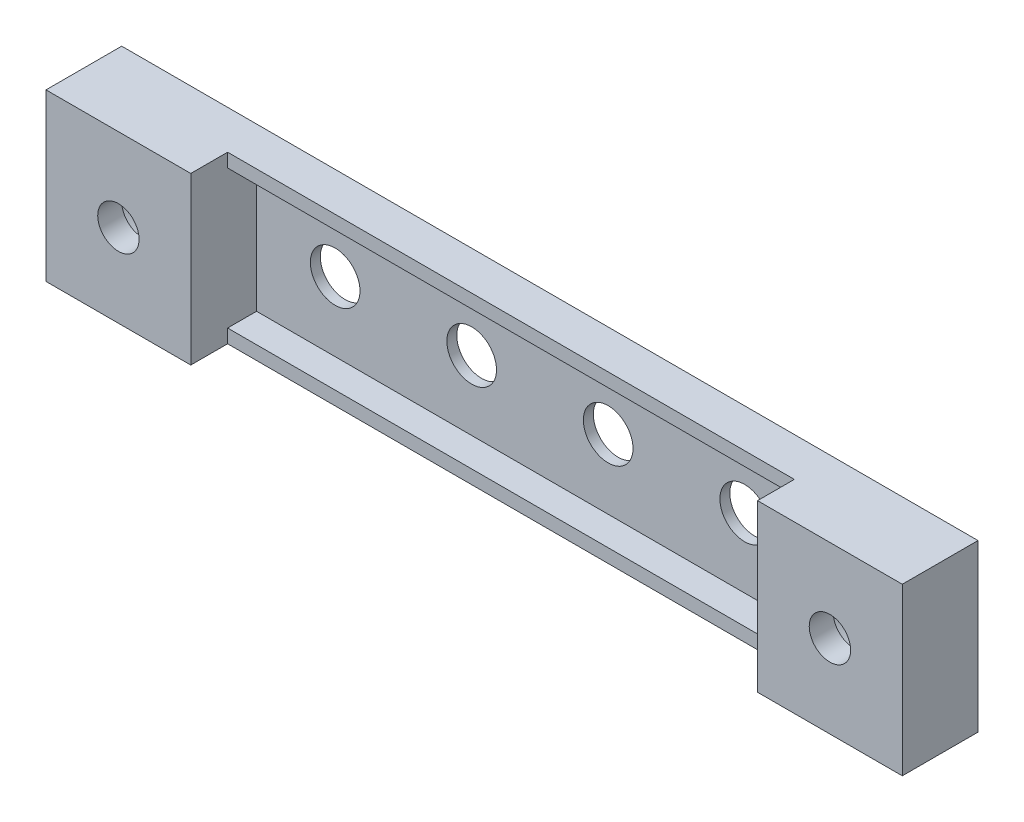
from build123d import *

# Parameters (mm, degrees)
SKETCH_1_W          = 27.4
SKETCH_1_H          = 6.7
EXTRUDE_1_DEPTH     = 1.4
SKETCH_2_W          = 3
SKETCH_2_H          = 8.022879097
EXTRUDE_2_DEPTH     = 1.78
SKETCH_3_W          = 33.4
SKETCH_3_H          = 8.022879097
EXTRUDE_6_DEPTH     = 0.58
SKETCH_4_R          = 1.2
CUT_EXTRUDE_1_DEPTH = 1
SKETCH_6_W          = 33.4
SKETCH_6_H          = 8.022879097
CUT_EXTRUDE_3_DEPTH = 0.1
SKETCH_7_W          = 3.66
SKETCH_7_H          = 8.022879097
EXTRUDE_7_DEPTH     = 4
SKETCH_8_R          = 2.5
CUT_EXTRUDE_4_DEPTH = 2.5
SKETCH_9_R          = 1
CUT_EXTRUDE_5_DEPTH = 5
SKETCH_10_W         = 3.66
SKETCH_10_H         = 8.022879097
EXTRUDE_8_DEPTH     = 4
SKETCH_11_R         = 2.5
CUT_EXTRUDE_6_DEPTH = 2.5
SKETCH_12_R         = 1
CUT_EXTRUDE_7_DEPTH = 2.5


with BuildPart() as part:
    # 스케치1 → 보스-돌출1 (new body)
    with BuildSketch(Plane.XY):
        Polygon((-16.7, -0.330719774), (16.7, -0.330719774), (16.7, 0.330719774), (16.7, 7.030719774), (16.7, 7.692159323), (-16.7, 7.692159323), (-16.7, 7.030719774), (-16.7, 0.330719774), align=None)
        with Locations((0, 3.680719774)):
            Rectangle(SKETCH_1_W, SKETCH_1_H, mode=Mode.SUBTRACT)
    extrude(amount=EXTRUDE_1_DEPTH)

    # 스케치2 → 보스-돌출2 (add)
    with BuildSketch(Plane.XY.offset(1.4)):
        with Locations((-15.2, 3.680719774)):
            Rectangle(SKETCH_2_W, SKETCH_2_H)
        with Locations((15.2, 3.680719774)):
            Rectangle(SKETCH_2_W, SKETCH_2_H)
    extrude(amount=EXTRUDE_2_DEPTH)

    # 스케치3 → 보스-돌출6 (add)
    with BuildSketch(Plane(origin=(0, 0, 0), x_dir=(-1, 0, 0), z_dir=(0, 0, -1))):
        with Locations((0, 3.680719774)):
            Rectangle(SKETCH_3_W, SKETCH_3_H)
    extrude(amount=EXTRUDE_6_DEPTH)

    # 스케치4 → 컷-돌출1 (cut)
    with BuildSketch(Plane(origin=(0, 0, -0.58), x_dir=(-1, 0, 0), z_dir=(0, 0, -1))):
        with Locations((-9.9, 3.680719774)):
            Circle(SKETCH_4_R)
        with Locations((-3.3, 3.680719774)):
            Circle(SKETCH_4_R)
        with Locations((3.3, 3.680719774)):
            Circle(SKETCH_4_R)
        with Locations((9.9, 3.680719774)):
            Circle(SKETCH_4_R)
    extrude(amount=-CUT_EXTRUDE_1_DEPTH, mode=Mode.SUBTRACT)

    # 스케치6 → 컷-돌출3 (cut)
    with BuildSketch(Plane(origin=(0, 0, -0.58), x_dir=(-1, 0, 0), z_dir=(0, 0, -1))):
        with Locations((0, 3.680719774)):
            Rectangle(SKETCH_6_W, SKETCH_6_H)
    extrude(amount=-CUT_EXTRUDE_3_DEPTH, mode=Mode.SUBTRACT)

    # 스케치7 → 보스-돌출7 (add)
    with BuildSketch(Plane.ZY.offset(16.7)):
        with Locations((1.35, 3.680719774)):
            Rectangle(SKETCH_7_W, SKETCH_7_H)
    extrude(amount=EXTRUDE_7_DEPTH)

    # 스케치8 → 컷-돌출4 (cut)
    with BuildSketch(Plane(origin=(0, 0, -0.48), x_dir=(-1, 0, 0), z_dir=(0, 0, -1))):
        with Locations((17.2, 3.680719774)):
            Circle(SKETCH_8_R)
    extrude(amount=-CUT_EXTRUDE_4_DEPTH, mode=Mode.SUBTRACT)

    # 스케치9 → 컷-돌출5 (cut)
    with BuildSketch(Plane(origin=(0, 0, 2.02), x_dir=(-1, 0, 0), z_dir=(0, 0, -1))):
        with Locations((17.2, 3.680719774)):
            Circle(SKETCH_9_R)
    extrude(amount=-CUT_EXTRUDE_5_DEPTH, mode=Mode.SUBTRACT)

    # 스케치10 → 보스-돌출8 (add)
    with BuildSketch(Plane(origin=(16.7, 0, 0), x_dir=(0, 0, -1), z_dir=(1, 0, 0))):
        with Locations((-1.35, 3.680719774)):
            Rectangle(SKETCH_10_W, SKETCH_10_H)
    extrude(amount=EXTRUDE_8_DEPTH)

    # 스케치11 → 컷-돌출6 (cut)
    with BuildSketch(Plane(origin=(0, 0, -0.48), x_dir=(-1, 0, 0), z_dir=(0, 0, -1))):
        with Locations((-17.2, 3.680719774)):
            Circle(SKETCH_11_R)
    extrude(amount=-CUT_EXTRUDE_6_DEPTH, mode=Mode.SUBTRACT)

    # 스케치12 → 컷-돌출7 (cut)
    with BuildSketch(Plane(origin=(0, 0, 2.02), x_dir=(-1, 0, 0), z_dir=(0, 0, -1))):
        with Locations((-17.2, 3.680719774)):
            Circle(SKETCH_12_R)
    extrude(amount=-CUT_EXTRUDE_7_DEPTH, mode=Mode.SUBTRACT)


solid = part.part
